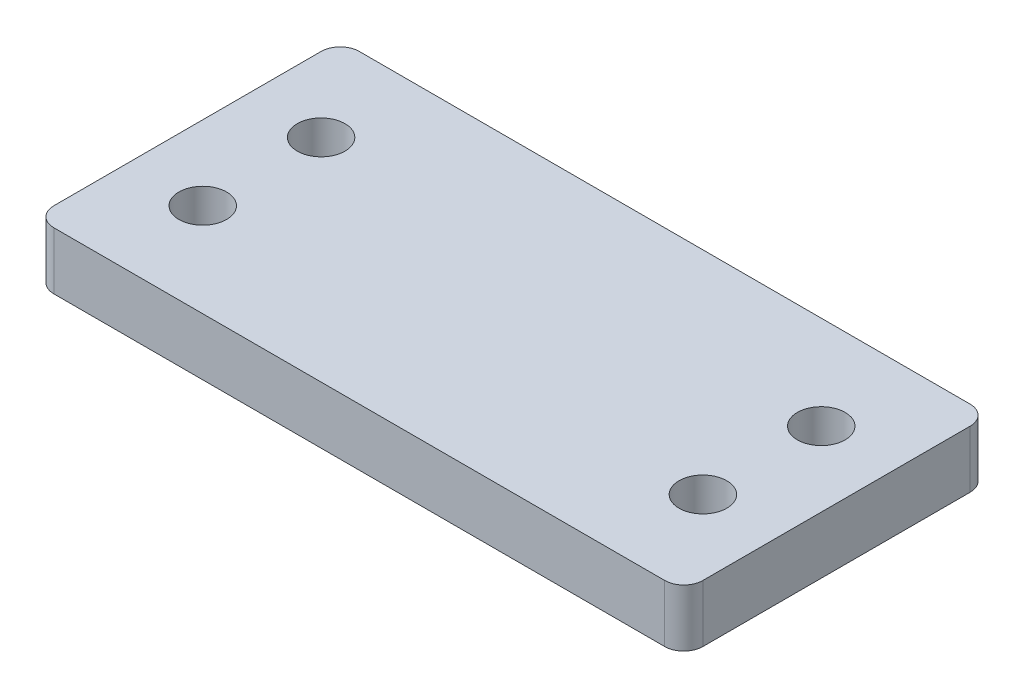
from build123d import *

# Parameters (mm, degrees)
SKETCH_3_W      = 34
SKETCH_3_H      = 16
EXTRUDE_3_DEPTH = 3
FILLET_1_R      = 1


with BuildPart() as part:
    # 草图3 → 凸台-拉伸3 (new body)
    with BuildSketch(Plane(origin=(0, 0, 0), x_dir=(1, 0, 0), z_dir=(0, 1, 0))):
        Rectangle(SKETCH_3_W, SKETCH_3_H)
        with BuildLine():
            ThreePointArc((-13.1, -4.35), (-11.85, -3.1), (-13.1, -1.85))
            ThreePointArc((-13.1, -1.85), (-14.35, -3.1), (-13.1, -4.35))
        make_face(mode=Mode.SUBTRACT)
        with BuildLine():
            ThreePointArc((13.1, -4.35), (14.35, -3.1), (13.1, -1.85))
            ThreePointArc((13.1, -1.85), (11.85, -3.1), (13.1, -4.35))
        make_face(mode=Mode.SUBTRACT)
        with BuildLine():
            ThreePointArc((13.1, 4.35), (11.85, 3.100000001), (13.1, 1.850000001))
            ThreePointArc((13.1, 1.850000001), (14.349999999, 3.1), (13.1, 4.35))
        make_face(mode=Mode.SUBTRACT)
        with BuildLine():
            ThreePointArc((-13.1, 1.85), (-11.85, 3.1), (-13.1, 4.349999999))
            ThreePointArc((-13.1, 4.349999999), (-14.35, 3.1), (-13.1, 1.85))
        make_face(mode=Mode.SUBTRACT)
    extrude(amount=EXTRUDE_3_DEPTH)

    # 圆角1
    fillet_1_edges = [part.edges().sort_by_distance(p)[0] for p in [
        (-17, 1.5, -8),
        (17, 1.5, -8),
        (17, 1.5, 8),
        (-17, 1.5, 8),
    ]]
    fillet(fillet_1_edges, radius=FILLET_1_R)


solid = part.part
